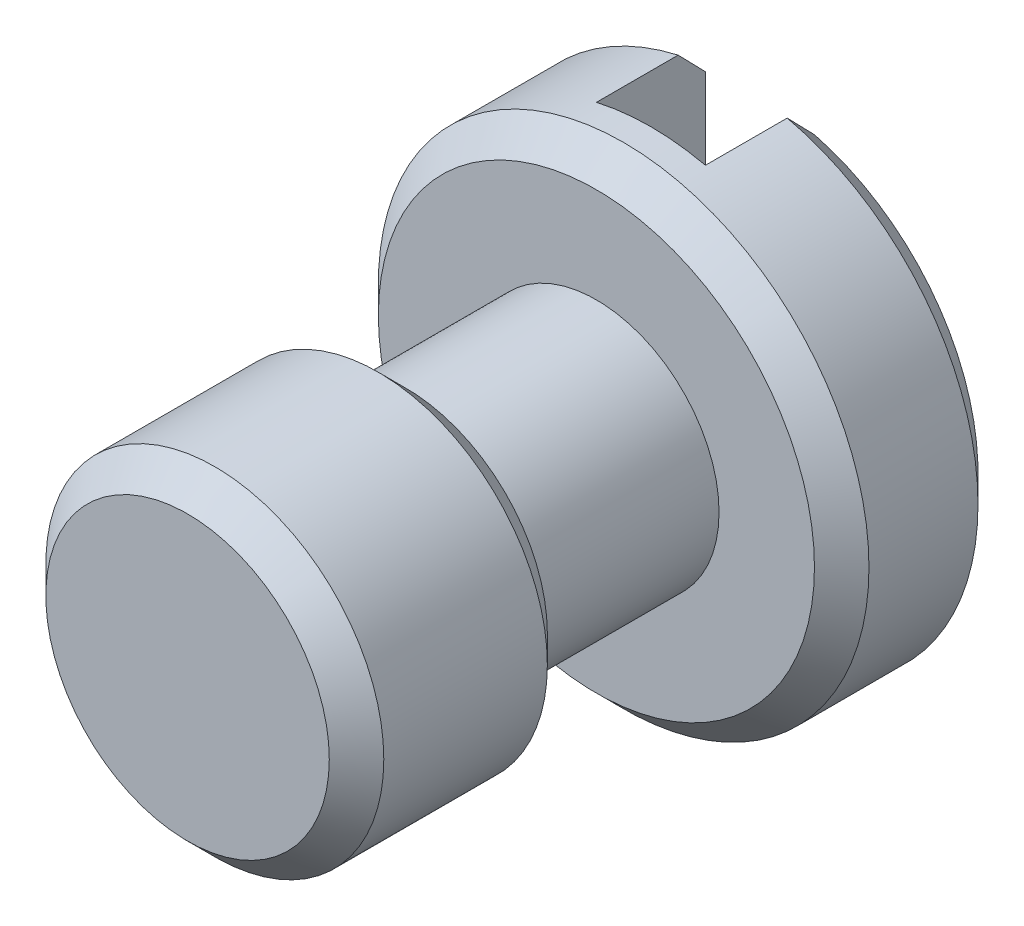
from build123d import *

# Parameters (mm, degrees)
SKETCH_1_R          = 4.5
EXTRUDE_1_DEPTH     = 3
SKETCH_2_R          = 2.25
EXTRUDE_2_DEPTH     = 3.5
SKETCH_3_R          = 3.1
EXTRUDE_3_DEPTH     = 4
CHAMFER_1_SIZE      = 0.5
SKETCH_4_W          = 2
SKETCH_4_H          = 10.520514376
CUT_EXTRUDE_1_DEPTH = 2


with BuildPart() as part:
    # Эскиз1 → Бобышка-Вытянуть1 (new body)
    with BuildSketch(Plane.XY):
        Circle(SKETCH_1_R)
    extrude(amount=EXTRUDE_1_DEPTH)

    # Эскиз2 → Бобышка-Вытянуть2 (add)
    with BuildSketch(Plane.XY.offset(3)):
        Circle(SKETCH_2_R)
    extrude(amount=EXTRUDE_2_DEPTH)

    # Эскиз3 → Бобышка-Вытянуть3 (add)
    with BuildSketch(Plane.XY.offset(6.5)):
        Circle(SKETCH_3_R)
    extrude(amount=EXTRUDE_3_DEPTH)

    # Фаска1
    chamfer_1_edges = [part.edges().sort_by_distance(p)[0] for p in [
        (-4.5, 0, 0),
        (-4.5, 0, 3),
        (-3.1, 0, 6.5),
        (-3.1, 0, 10.5),
    ]]
    chamfer(chamfer_1_edges, length=CHAMFER_1_SIZE)

    # Эскиз4 → Вырез-Вытянуть1 (cut)
    with BuildSketch(Plane(origin=(0, 0, 0), x_dir=(-1, 0, 0), z_dir=(0, 0, -1))):
        Rectangle(SKETCH_4_W, SKETCH_4_H)
    extrude(amount=-CUT_EXTRUDE_1_DEPTH, mode=Mode.SUBTRACT)


solid = part.part
